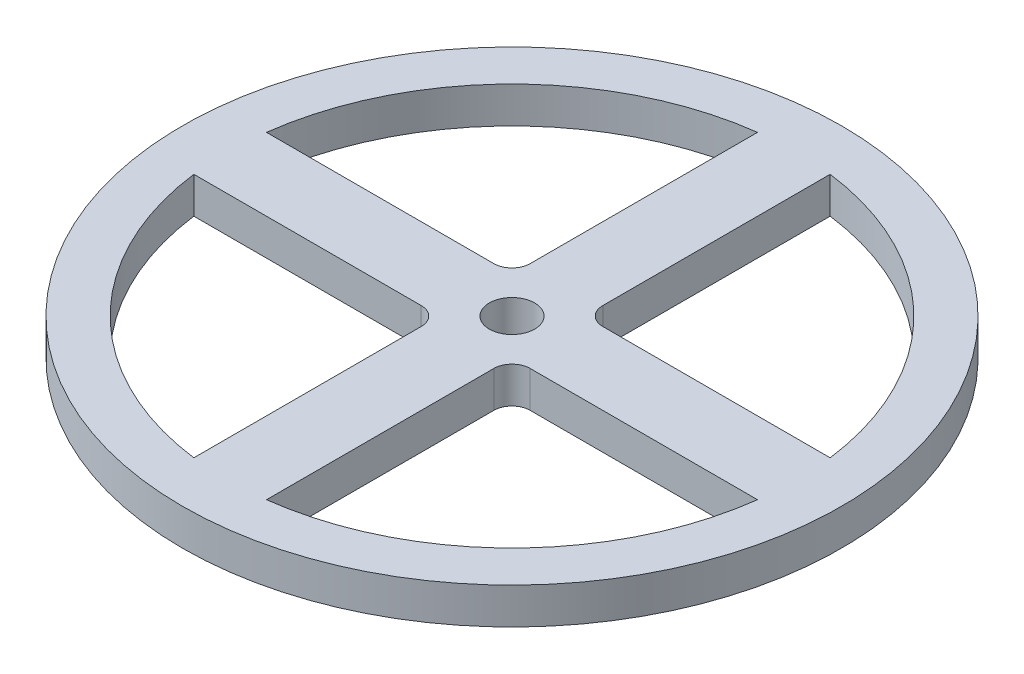
from build123d import *

# Parameters (mm, degrees)
SKETCH1_R           = 36.3
SKETCH1_R_2         = 2.5
BOSS_EXTRUDE1_DEPTH = 4


with BuildPart() as part:
    # Sketch1 → Boss-Extrude1 (new body)
    with BuildSketch(Plane(origin=(0, 0, 0), x_dir=(1, 0, 0), z_dir=(0, 1, 0))):
        with Locations(Location((0, 0, 0), (0, 0, 270))):
            Circle(SKETCH1_R)
        with Locations(Location((0, 0, 0), (0, 0, 270))):
            Circle(SKETCH1_R_2, mode=Mode.SUBTRACT)
        with BuildLine():
            ThreePointArc((4, -31.043356777), (22.132442251, -22.132442251), (31.043356777, -4))
            Line((31.043356777, -4), (6, -4))
            ThreePointArc((6, -4), (4.585786438, -4.585786438), (4, -6))
            Line((4, -6), (4, -31.043356777))
        make_face(mode=Mode.SUBTRACT)
        with BuildLine():
            ThreePointArc((31.043356777, 4), (22.132442251, 22.132442251), (4, 31.043356777))
            Line((4, 31.043356777), (4, 6))
            ThreePointArc((4, 6), (4.585786438, 4.585786438), (6, 4))
            Line((6, 4), (31.043356777, 4))
        make_face(mode=Mode.SUBTRACT)
        with BuildLine():
            ThreePointArc((-4, 31.043356777), (-22.132442251, 22.132442251), (-31.043356777, 4))
            Line((-31.043356777, 4), (-6, 4))
            ThreePointArc((-6, 4), (-4.585786438, 4.585786438), (-4, 6))
            Line((-4, 6), (-4, 31.043356777))
        make_face(mode=Mode.SUBTRACT)
        with BuildLine():
            Line((-31.043356777, -4), (-6, -4))
            ThreePointArc((-6, -4), (-4.585786438, -4.585786438), (-4, -6))
            Line((-4, -6), (-4, -31.043356777))
            ThreePointArc((-4, -31.043356777), (-22.132442251, -22.132442251), (-31.043356777, -4))
        make_face(mode=Mode.SUBTRACT)
    extrude(amount=BOSS_EXTRUDE1_DEPTH)


solid = part.part
